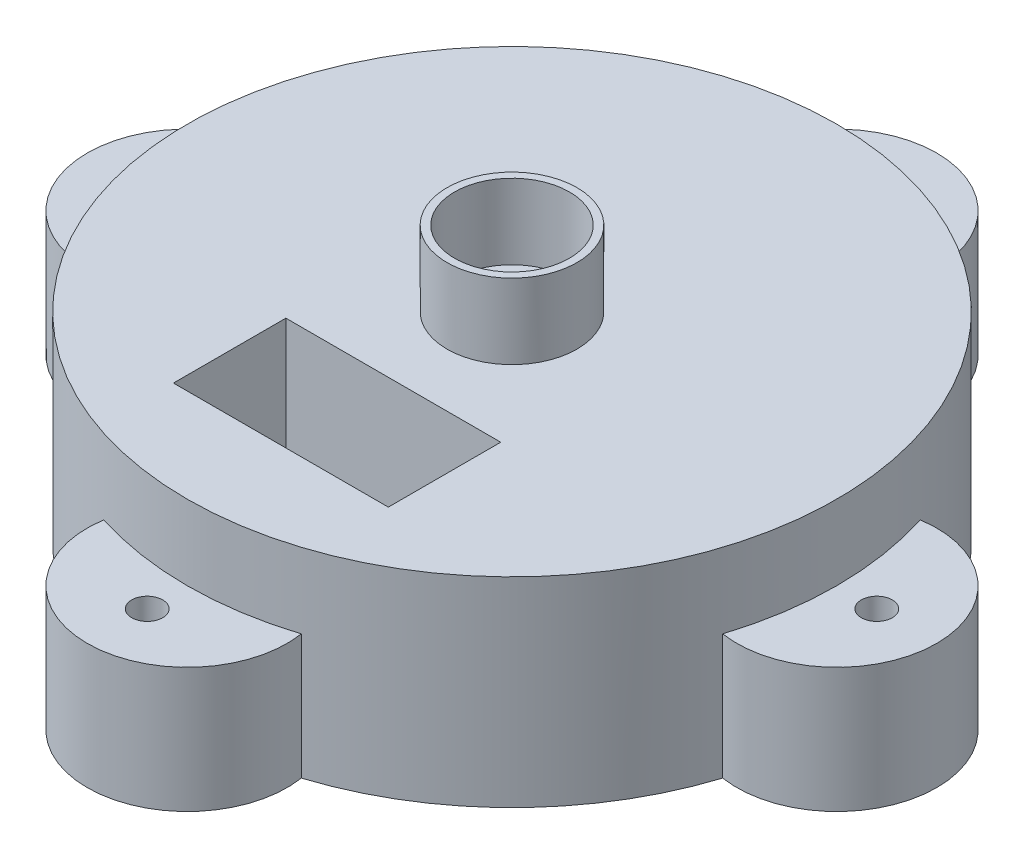
from build123d import *

# Parameters (mm, degrees)
SKETCH2_R           = 65
BOSS_EXTRUDE1_DEPTH = 40
SKETCH4_W           = 43
SKETCH4_H           = 22.5
CUT_EXTRUDE1_DEPTH  = 38
SKETCH6_R           = 3.1
BOSS_EXTRUDE2_DEPTH = 25
SKETCH9_R           = 13
SKETCH9_R_2         = 11.5
BOSS_EXTRUDE3_DEPTH = 15
SKETCH5_W           = 15
SKETCH5_H           = 5
CUT_EXTRUDE2_DEPTH  = 60


with BuildPart() as part:
    # Sketch2 → Boss-Extrude1 (new body)
    with BuildSketch(Plane(origin=(0, 0, 0), x_dir=(1, 0, 0), z_dir=(0, 1, 0))):
        with Locations(Location((0, 0, 0), (0, 0, 270))):
            Circle(SKETCH2_R)
    extrude(amount=BOSS_EXTRUDE1_DEPTH)

    # Sketch4 → Cut-Extrude1 (cut)
    with BuildSketch(Plane.XZ.offset(-40)):
        with Locations((0, 35)):
            Rectangle(SKETCH4_W, SKETCH4_H)
    extrude(amount=CUT_EXTRUDE1_DEPTH, mode=Mode.SUBTRACT)

    # Sketch6 → Boss-Extrude2 (add)
    # profile 1 of 4: a face of its own
    with BuildSketch(Plane(origin=(0, 0, 0), x_dir=(1, 0, 0), z_dir=(0, 1, 0))):
        with BuildLine():
            ThreePointArc((-61.923102255, -19.761816899), (-65, 8.332e-05), (-61.923051591, 19.761975651))
            ThreePointArc((-61.923051591, 19.761975651), (-85, 0.000108957), (-61.923102255, -19.761816899))
        make_face()
        with Locations(Location((-73, 8.332e-05, 0), (0, 0, 90))):
            Circle(SKETCH6_R, mode=Mode.SUBTRACT)
    # profile 2 of 4: a face of its own
    with BuildSketch(Plane(origin=(0, 0, 0), x_dir=(1, 0, 0), z_dir=(0, 1, 0))):
        with BuildLine():
            ThreePointArc((19.761975651, 61.923051591), (0.000108957, 85), (-19.761816899, 61.923102255))
            ThreePointArc((-19.761816899, 61.923102255), (8.332e-05, 65), (19.761975651, 61.923051591))
        make_face()
        with Locations(Location((8.332e-05, 73, 0), (0, 0, 90))):
            Circle(SKETCH6_R, mode=Mode.SUBTRACT)
    # profile 3 of 4: a face of its own
    with BuildSketch(Plane(origin=(0, 0, 0), x_dir=(1, 0, 0), z_dir=(0, 1, 0))):
        with BuildLine():
            ThreePointArc((19.761816899, -61.923102255), (-8.332e-05, -65), (-19.761975651, -61.923051591))
            ThreePointArc((-19.761975651, -61.923051591), (-0.000108957, -85), (19.761816899, -61.923102255))
        make_face()
        with Locations(Location((-8.332e-05, -73, 0), (0, 0, 90))):
            Circle(SKETCH6_R, mode=Mode.SUBTRACT)
    # profile 4 of 4: a face of its own
    with BuildSketch(Plane(origin=(0, 0, 0), x_dir=(1, 0, 0), z_dir=(0, 1, 0))):
        with BuildLine():
            ThreePointArc((61.923051591, -19.761975651), (85, -0.000108957), (61.923102255, 19.761816899))
            ThreePointArc((61.923102255, 19.761816899), (65, -8.332e-05), (61.923051591, -19.761975651))
        make_face()
        with Locations(Location((73, -8.332e-05, 0), (0, 0, 90))):
            Circle(SKETCH6_R, mode=Mode.SUBTRACT)
    extrude(amount=BOSS_EXTRUDE2_DEPTH)

    # Sketch9 → Boss-Extrude3 (add)
    with BuildSketch(Plane(origin=(0, 40, 0), x_dir=(-1, 0, 0), z_dir=(0, -1, 0))):
        with Locations(Location((0, 0, 0), (0, 0, 90))):
            Circle(SKETCH9_R)
        with Locations(Location((0, 0, 0), (0, 0, 90))):
            Circle(SKETCH9_R_2, mode=Mode.SUBTRACT)
    extrude(amount=-BOSS_EXTRUDE3_DEPTH)

    # Sketch5 → Cut-Extrude2 (cut)
    with BuildSketch(Plane(origin=(-21.5, 0, 62.75), x_dir=(0, 0, 1), z_dir=(-1, 0, 0))):
        with Locations((-26.716652448, 9.82604923)):
            Rectangle(SKETCH5_W, SKETCH5_H)
    extrude(amount=CUT_EXTRUDE2_DEPTH, mode=Mode.SUBTRACT)


solid = part.part
